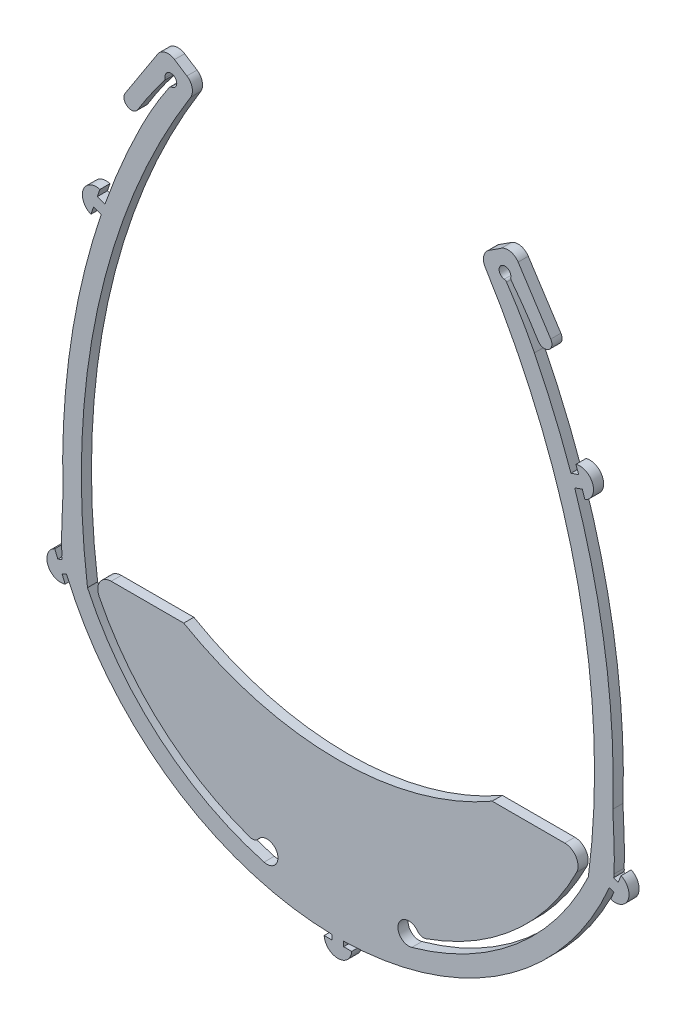
from build123d import *

# Parameters (mm, degrees)
BOSS_EXTRUDE1_DEPTH = 3.175


with BuildPart() as part:
    # Sketch1 → Boss-Extrude1 (new body)
    with BuildSketch(Plane.XY):
        with BuildLine():
            Line((-38.232117525, -48.334989908), (-60.961358056, -48.334989908))
            ThreePointArc((-60.961358056, -48.334989908), (-64.527927466, -50.321470228), (-64.71669447, -54.399568858))
            ThreePointArc((-64.71669447, -54.399568858), (-45.162805162, -79.848709383), (-17.459350628, -96.051547015))
            ThreePointArc((-17.459350628, -96.051547015), (-16.036418216, -96.080038848), (-14.87146367, -95.262463569))
            ThreePointArc((-14.87146367, -95.262463569), (-8.888558673, -96.210030714), (-13.045252985, -100.616268123))
            ThreePointArc((-13.045252985, -100.616268123), (-45.845334299, -83.275759663), (-68.380015164, -53.801589172))
            ThreePointArc((-68.380015164, -53.801589172), (-65.192805425, 23.622083996), (-36.073719239, 95.431987857))
            ThreePointArc((-36.073719239, 95.431987857), (-35.587957482, 98.278797412), (-37.236596684, 100.64993172))
            Line((-37.236596684, 100.64993172), (-41.103624033, 103.155671407))
            ThreePointArc((-41.103624033, 103.155671407), (-43.974377986, 103.684742176), (-46.378417101, 102.028922117))
            Line((-46.378417101, 102.028922117), (-56.599560294, 86.254961047))
            ThreePointArc((-56.599560294, 86.254961047), (-56.917224028, 84.531308043), (-55.923039481, 83.087879135))
            Line((-55.923039481, 83.087879135), (-55.853863949, 83.043055072))
            ThreePointArc((-55.853863949, 83.043055072), (-54.103522344, 82.73125901), (-52.657612543, 83.765791448))
            ThreePointArc((-52.657612543, 83.765791448), (-48.619561631, 89.956003624), (-44.25417952, 95.919896729))
            ThreePointArc((-44.25417952, 95.919896729), (-44.070317424, 96.300411286), (-44.056473461, 96.722791379))
            ThreePointArc((-44.056473461, 96.722791379), (-41.15632655, 98.522939289), (-42.02094997, 95.220847385))
            ThreePointArc((-42.02094997, 95.220847385), (-42.426877037, 95.079143581), (-42.7383511, 94.782764332))
            ThreePointArc((-42.7383511, 94.782764332), (-47.349935461, 87.504452643), (-51.469836467, 79.936959858))
            ThreePointArc((-51.469836467, 79.936959858), (-57.625378953, 66.65222576), (-62.931273284, 53.005894799))
            Line((-62.931273284, 53.005894799), (-65.323416618, 53.829575804))
            Line((-65.323416618, 53.829575804), (-64.498829719, 56.224350047))
            ThreePointArc((-64.498829719, 56.224350047), (-69.753703666, 53.470378819), (-67.308320476, 48.064996429))
            Line((-67.308320476, 48.064996429), (-66.483733576, 50.459770671))
            Line((-66.483733576, 50.459770671), (-64.091590242, 49.636089666))
            ThreePointArc((-64.091590242, 49.636089666), (-73.69068183, 9.552817578), (-76.050385999, -31.596217123))
            add(Edge.make_bspline(
                [(-76.413674196, -49.035912557), (-76.490697688, -47.59159519), (-76.544524485, -44.699239364), (-76.422918165, -40.352613355), (-76.213699928, -35.991352831), (-76.089673965, -33.05979149), (-76.050385999, -31.596217123)],
                knots=[0.05307402, 0.05307402, 0.05307402, 0.05307402, 0.290327129, 0.527580238, 0.764833347, 1.002086455, 1.002086455, 1.002086455, 1.002086455], degree=3))
            ThreePointArc((-76.413674196, -49.035912557), (-76.449546072, -49.595209625), (-76.264758395, -50.124315962))
            Line((-76.264758395, -50.124315962), (-77.685109529, -50.698175071))
            Line((-77.685109529, -50.698175071), (-78.633899161, -48.349838327))
            ThreePointArc((-78.633899161, -48.349838327), (-80.793035183, -53.875794296), (-75.401231139, -56.350972449))
            Line((-75.401231139, -56.350972449), (-76.350020771, -54.002635705))
            Line((-76.350020771, -54.002635705), (-74.949113638, -53.436632483))
            ThreePointArc((-74.949113638, -53.436632483), (-41.608142422, -93.807518365), (8.312838811, -109.597528539))
            Line((8.312838811, -109.597528539), (8.312838811, -111.108455553))
            Line((8.312838811, -111.108455553), (5.780076045, -111.108455553))
            ThreePointArc((5.780076045, -111.108455553), (10.094826611, -115.180431153), (14.409577176, -111.108455553))
            Line((14.409577176, -111.108455553), (11.876814411, -111.108455553))
            Line((11.876814411, -111.108455553), (11.876814411, -109.597528539))
            ThreePointArc((11.876814411, -109.597528539), (61.797795644, -93.807518365), (95.138766859, -53.436632483))
            Line((95.138766859, -53.436632483), (96.539673992, -54.002635705))
            Line((96.539673992, -54.002635705), (95.590884361, -56.350972449))
            ThreePointArc((95.590884361, -56.350972449), (100.982688404, -53.875794296), (98.823552382, -48.349838327))
            Line((98.823552382, -48.349838327), (97.874762751, -50.698175071))
            Line((97.874762751, -50.698175071), (96.454411616, -50.124315962))
            ThreePointArc((96.454411616, -50.124315962), (96.639199294, -49.595209625), (96.603327418, -49.035912557))
            add(Edge.make_bspline(
                [(96.240039221, -31.596217123), (96.279327187, -33.05979149), (96.40335315, -35.991352831), (96.612571387, -40.352613355), (96.734177707, -44.699239364), (96.68035091, -47.59159519), (96.603327418, -49.035912557)],
                knots=[0.051381708, 0.051381708, 0.051381708, 0.051381708, 0.288634817, 0.525887926, 0.763141035, 1.000394144, 1.000394144, 1.000394144, 1.000394144], degree=3))
            ThreePointArc((96.240039221, -31.596217123), (93.880335052, 9.552817578), (84.281243464, 49.636089666))
            Line((84.281243464, 49.636089666), (86.673386798, 50.459770671))
            Line((86.673386798, 50.459770671), (87.497973697, 48.064996429))
            ThreePointArc((87.497973697, 48.064996429), (89.943356888, 53.470378819), (84.68848294, 56.224350047))
            Line((84.68848294, 56.224350047), (85.513069839, 53.829575804))
            Line((85.513069839, 53.829575804), (83.120926505, 53.005894799))
            ThreePointArc((83.120926505, 53.005894799), (77.815032175, 66.65222576), (71.659489689, 79.936959858))
            ThreePointArc((71.659489689, 79.936959858), (67.539588683, 87.504452643), (62.928004321, 94.782764332))
            ThreePointArc((62.928004321, 94.782764332), (62.616530258, 95.079143581), (62.210603192, 95.220847385))
            ThreePointArc((62.210603192, 95.220847385), (61.345979772, 98.522939289), (64.246126683, 96.722791379))
            ThreePointArc((64.246126683, 96.722791379), (64.259970645, 96.300411286), (64.443832742, 95.919896729))
            ThreePointArc((64.443832742, 95.919896729), (68.809214853, 89.956003624), (72.847265765, 83.765791448))
            ThreePointArc((72.847265765, 83.765791448), (74.293175566, 82.73125901), (76.04351717, 83.043055072))
            Line((76.04351717, 83.043055072), (76.112692703, 83.087879135))
            ThreePointArc((76.112692703, 83.087879135), (77.10687725, 84.531308043), (76.789213515, 86.254961047))
            Line((76.789213515, 86.254961047), (66.568070323, 102.028922117))
            ThreePointArc((66.568070323, 102.028922117), (64.164031207, 103.684742176), (61.293277254, 103.155671407))
            Line((61.293277254, 103.155671407), (57.426249905, 100.64993172))
            ThreePointArc((57.426249905, 100.64993172), (55.777610703, 98.278797412), (56.26337246, 95.431987857))
            ThreePointArc((56.26337246, 95.431987857), (85.382458646, 23.622083996), (88.569668386, -53.801589172))
            ThreePointArc((88.569668386, -53.801589172), (66.03498752, -83.275759663), (33.234906206, -100.616268123))
            ThreePointArc((33.234906206, -100.616268123), (29.078211895, -96.210030714), (35.061116892, -95.262463569))
            ThreePointArc((35.061116892, -95.262463569), (36.226071438, -96.080038848), (37.649003849, -96.051547015))
            ThreePointArc((37.649003849, -96.051547015), (65.352458384, -79.848709383), (84.906347691, -54.399568858))
            ThreePointArc((84.906347691, -54.399568858), (84.717580687, -50.321470228), (81.151011278, -48.334989908))
            Line((81.151011278, -48.334989908), (58.421770747, -48.334989908))
            ThreePointArc((58.421770747, -48.334989908), (10.094826611, -61.266217935), (-38.232117525, -48.334989908))
        make_face()
    extrude(amount=BOSS_EXTRUDE1_DEPTH)


solid = part.part
